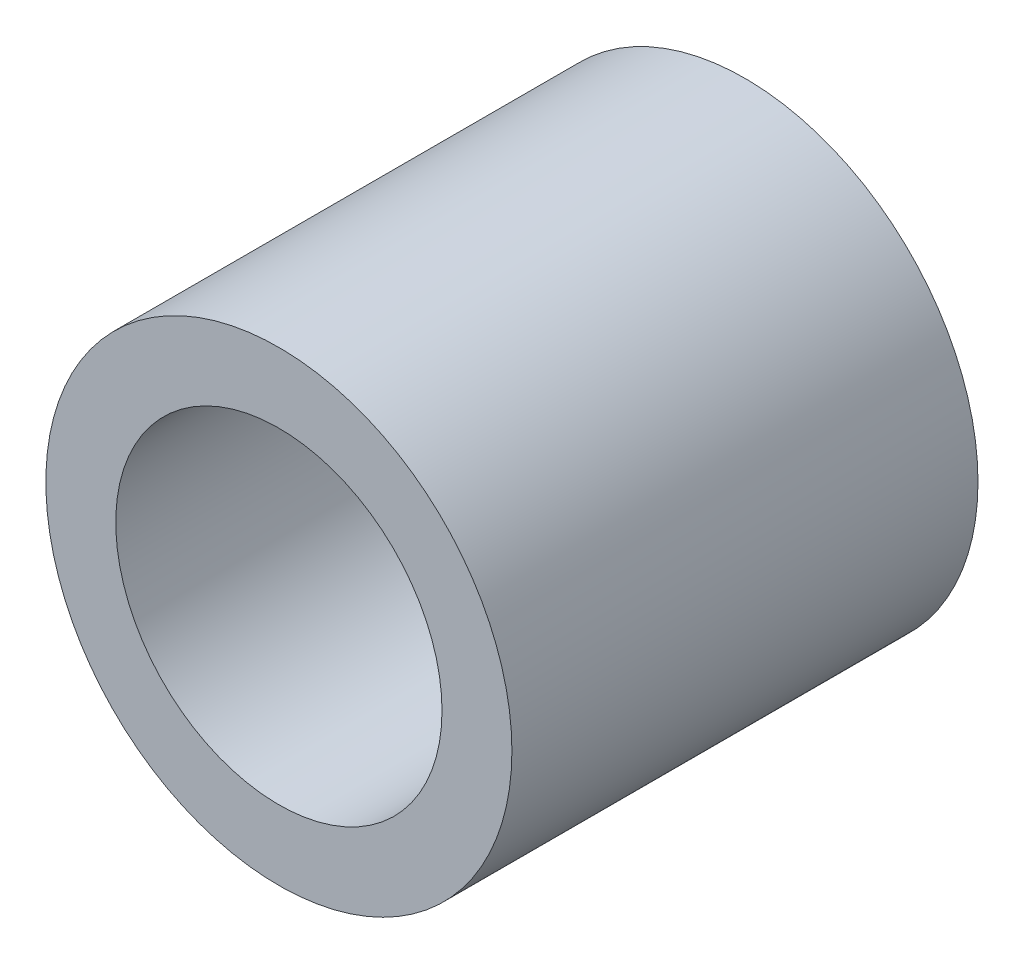
from build123d import *

# Parameters (mm, degrees)
SKETCH_1_R      = 25
SKETCH_1_R_2    = 17.5
EXTRUDE_1_DEPTH = 50


with BuildPart() as part:
    # Эскиз1 → Бобышка-Вытянуть1 (new body)
    with BuildSketch(Plane.XY):
        Circle(SKETCH_1_R)
        Circle(SKETCH_1_R_2, mode=Mode.SUBTRACT)
    extrude(amount=EXTRUDE_1_DEPTH)


solid = part.part
